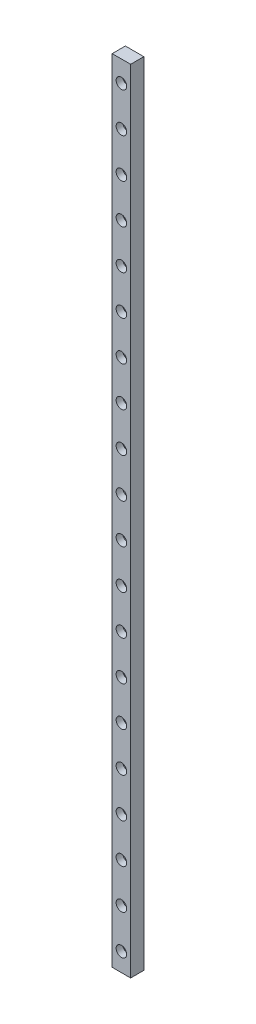
from build123d import *

# Parameters (mm, degrees)
SKETCH_1_W          = 7
SKETCH_1_H          = 5
EXTRUDE_1_DEPTH     = 300
SKETCH_2_R          = 1.25
CUT_EXTRUDE_1_DEPTH = 300
SKETCH_3_R          = 2
CUT_EXTRUDE_2_DEPTH = 2.5


with BuildPart() as part:
    # 草图1 → 凸台-拉伸1 (new body)
    with BuildSketch(Plane(origin=(0, 0, 0), x_dir=(1, 0, 0), z_dir=(0, 1, 0))):
        Rectangle(SKETCH_1_W, SKETCH_1_H)
    extrude(amount=EXTRUDE_1_DEPTH)

    # 草图2 → 切除-拉伸1 (cut)
    with BuildSketch(Plane.XY.offset(2.5)):
        with Locations((0, 7)):
            Circle(SKETCH_2_R)
        with Locations((0, 22)):
            Circle(SKETCH_2_R)
        with Locations((0, 37)):
            Circle(SKETCH_2_R)
        with Locations((0, 52)):
            Circle(SKETCH_2_R)
        with Locations((0, 67)):
            Circle(SKETCH_2_R)
        with Locations((0, 82)):
            Circle(SKETCH_2_R)
        with Locations((0, 97)):
            Circle(SKETCH_2_R)
        with Locations((0, 112)):
            Circle(SKETCH_2_R)
        with Locations((0, 127)):
            Circle(SKETCH_2_R)
        with Locations((0, 142)):
            Circle(SKETCH_2_R)
        with Locations((0, 157)):
            Circle(SKETCH_2_R)
        with Locations((0, 172)):
            Circle(SKETCH_2_R)
        with Locations((0, 187)):
            Circle(SKETCH_2_R)
        with Locations((0, 202)):
            Circle(SKETCH_2_R)
        with Locations((0, 217)):
            Circle(SKETCH_2_R)
        with Locations((0, 232)):
            Circle(SKETCH_2_R)
        with Locations((0, 247)):
            Circle(SKETCH_2_R)
        with Locations((0, 262)):
            Circle(SKETCH_2_R)
        with Locations((0, 277)):
            Circle(SKETCH_2_R)
        with Locations((0, 292)):
            Circle(SKETCH_2_R)
    extrude(amount=-CUT_EXTRUDE_1_DEPTH, mode=Mode.SUBTRACT)

    # 草图3 → 切除-拉伸2 (cut)
    with BuildSketch(Plane.XY.offset(2.5)):
        with Locations((0, 7)):
            Circle(SKETCH_3_R)
        with Locations((0, 22)):
            Circle(SKETCH_3_R)
        with Locations((0, 37)):
            Circle(SKETCH_3_R)
        with Locations((0, 52)):
            Circle(SKETCH_3_R)
        with Locations((0, 67)):
            Circle(SKETCH_3_R)
        with Locations((0, 82)):
            Circle(SKETCH_3_R)
        with Locations((0, 97)):
            Circle(SKETCH_3_R)
        with Locations((0, 112)):
            Circle(SKETCH_3_R)
        with Locations((0, 127)):
            Circle(SKETCH_3_R)
        with Locations((0, 142)):
            Circle(SKETCH_3_R)
        with Locations((0, 157)):
            Circle(SKETCH_3_R)
        with Locations((0, 172)):
            Circle(SKETCH_3_R)
        with Locations((0, 187)):
            Circle(SKETCH_3_R)
        with Locations((0, 202)):
            Circle(SKETCH_3_R)
        with Locations((0, 217)):
            Circle(SKETCH_3_R)
        with Locations((0, 232)):
            Circle(SKETCH_3_R)
        with Locations((0, 247)):
            Circle(SKETCH_3_R)
        with Locations((0, 262)):
            Circle(SKETCH_3_R)
        with Locations((0, 277)):
            Circle(SKETCH_3_R)
        with Locations((0, 292)):
            Circle(SKETCH_3_R)
    extrude(amount=-CUT_EXTRUDE_2_DEPTH, mode=Mode.SUBTRACT)


solid = part.part
